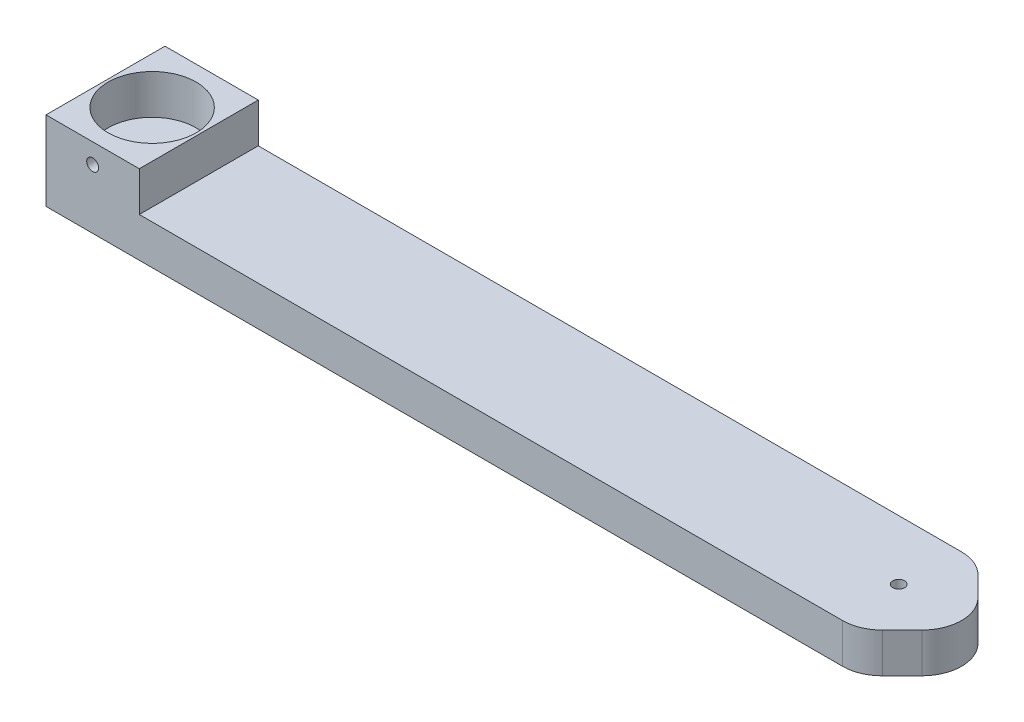
from build123d import *

# Parameters (mm, degrees)
SKETCH1_W           = 220
SKETCH1_H           = 30
BOSS_EXTRUDE1_DEPTH = 10
SKETCH2_W           = 23.523691572
SKETCH2_H           = 30
SKETCH2_R           = 11.1
BOSS_EXTRUDE3_DEPTH = 10
SKETCH6_R           = 1.5
CUT_EXTRUDE2_DEPTH  = 10
CUT_EXTRUDE3_START  = -10
SKETCH4_R           = 4
CUT_EXTRUDE3_DEPTH  = 4
SKETCH7_R           = 1.5
CUT_EXTRUDE4_DEPTH  = 14
CUT_EXTRUDE5_DEPTH  = 10
FILLET1_R           = 10


with BuildPart() as part:
    # Sketch1 → Boss-Extrude1 (new body)
    with BuildSketch(Plane(origin=(0, 0, 0), x_dir=(1, 0, 0), z_dir=(0, 1, 0))):
        Rectangle(SKETCH1_W, SKETCH1_H)
    extrude(amount=BOSS_EXTRUDE1_DEPTH)

    # Sketch2 → Boss-Extrude3 (add)
    with BuildSketch(Plane(origin=(0, 10, 0), x_dir=(1, 0, 0), z_dir=(0, 1, 0))):
        with Locations((-98.238154214, 0)):
            Rectangle(SKETCH2_W, SKETCH2_H)
        with Locations(Location((-98.238154214, 0, 0), (0, 0, 270))):
            Circle(SKETCH2_R, mode=Mode.SUBTRACT)
    extrude(amount=BOSS_EXTRUDE3_DEPTH)

    # Sketch6 → Cut-Extrude2 (cut)
    with BuildSketch(Plane.XY.offset(15)):
        with Locations((-98.238154214, 15)):
            Circle(SKETCH6_R)
    extrude(amount=-CUT_EXTRUDE2_DEPTH, mode=Mode.SUBTRACT)

    # Sketch4 → Cut-Extrude3 (cut)
    with BuildSketch(Plane(origin=(0, 10, 0), x_dir=(1, 0, 0), z_dir=(0, 1, 0)).offset(CUT_EXTRUDE3_START)):
        with Locations(Location((90, 0, 0), (0, 0, 90))):
            Circle(SKETCH4_R)
    extrude(amount=CUT_EXTRUDE3_DEPTH, mode=Mode.SUBTRACT)

    # Sketch7 → Cut-Extrude4 (cut)
    with BuildSketch(Plane(origin=(0, 4, 0), x_dir=(-1, 0, 0), z_dir=(0, -1, 0))):
        with Locations(Location((-90, 0, 0), (0, 0, 90))):
            Circle(SKETCH7_R)
    extrude(amount=-CUT_EXTRUDE4_DEPTH, mode=Mode.SUBTRACT)

    # Sketch8 → Cut-Extrude5 (cut)
    with BuildSketch(Plane(origin=(0, 10, 0), x_dir=(1, 0, 0), z_dir=(0, 1, 0))):
        Polygon((110, -15), (110, 0), (95, -15), align=None)
        Polygon((110, 15), (95, 15), (110, 0), align=None)
    extrude(amount=-CUT_EXTRUDE5_DEPTH, mode=Mode.SUBTRACT)

    # Fillet1
    fillet1_edges = [part.edges().sort_by_distance(p)[0] for p in [
        (110, 5, 0),
        (95, 5, 15),
        (95, 5, -15),
    ]]
    fillet(fillet1_edges, radius=FILLET1_R)


solid = part.part
